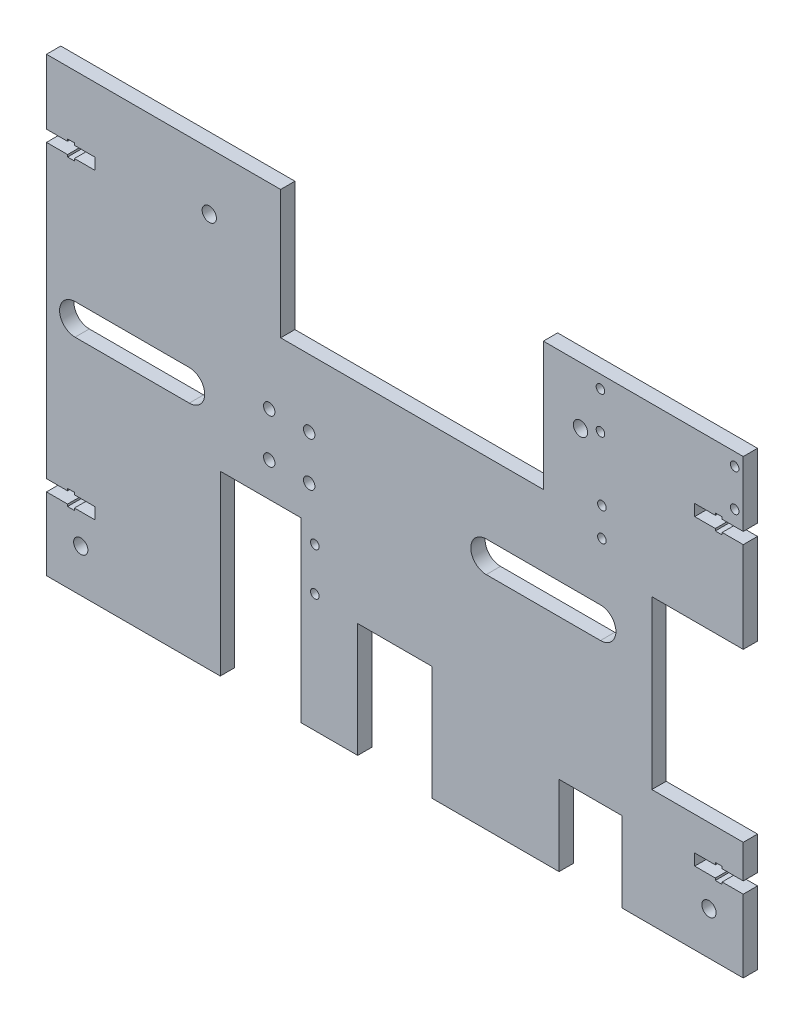
from build123d import *

# Parameters (mm, degrees)
SKETCH1_W           = 244
SKETCH1_H           = 158.154567899
BOSS_EXTRUDE2_DEPTH = 5
SKETCH2_W           = 28.286613298
SKETCH2_H           = 62.131328865
CUT_EXTRUDE1_DEPTH  = 10
SKETCH7_W           = 32
SKETCH7_H           = 84.5
CUT_EXTRUDE5_DEPTH  = 10
SKETCH9_R           = 1.5
CUT_EXTRUDE7_DEPTH  = 10
SKETCH10_W          = 26
SKETCH10_H          = 40
CUT_EXTRUDE8_DEPTH  = 10
SKETCH12_W          = 92
SKETCH12_H          = 45
CUT_EXTRUDE10_DEPTH = 10
SKETCH13_R          = 2.5
CUT_EXTRUDE11_DEPTH = 10
CUT_EXTRUDE12_DEPTH = 10
SKETCH15_W          = 32
SKETCH15_H          = 26
BOSS_EXTRUDE3_DEPTH = 5
SKETCH16_R          = 1.5
CUT_EXTRUDE13_DEPTH = 10
SKETCH17_R          = 1.5
CUT_EXTRUDE14_DEPTH = 10
SKETCH19_R          = 2
CUT_EXTRUDE16_DEPTH = 10
SKETCH20_W          = 22
SKETCH20_H          = 28
CUT_EXTRUDE17_DEPTH = 10
CUT_EXTRUDE18_DEPTH = 10


with BuildPart() as part:
    # Sketch1 → Boss-Extrude2 (new body)
    with BuildSketch(Plane.XY):
        with Locations((-3, -45.239754423)):
            Rectangle(SKETCH1_W, SKETCH1_H)
    extrude(amount=BOSS_EXTRUDE2_DEPTH)

    # Sketch2 → Cut-Extrude1 (cut)
    with BuildSketch(Plane(origin=(0, 0, 0), x_dir=(-1, 0, 0), z_dir=(0, 0, -1))):
        with Locations((50, -93.25137394)):
            Rectangle(SKETCH2_W, SKETCH2_H)
    extrude(amount=-CUT_EXTRUDE1_DEPTH, mode=Mode.SUBTRACT)

    # Sketch7 → Cut-Extrude5 (cut)
    with BuildSketch(Plane(origin=(0, 0, 0), x_dir=(-1, 0, 0), z_dir=(0, 0, -1))):
        with Locations((-103, -40.912470473)):
            Rectangle(SKETCH7_W, SKETCH7_H)
    extrude(amount=-CUT_EXTRUDE5_DEPTH, mode=Mode.SUBTRACT)

    # Sketch9 → Cut-Extrude7 (cut)
    with BuildSketch(Plane(origin=(0, 0, 0), x_dir=(-1, 0, 0), z_dir=(0, 0, -1))):
        with Locations((31.026566737, -67.835709507)):
            Circle(SKETCH9_R)
        with Locations((31.026566737, -82.835709507)):
            Circle(SKETCH9_R)
    extrude(amount=-CUT_EXTRUDE7_DEPTH, mode=Mode.SUBTRACT)

    # Sketch10 → Cut-Extrude8 (cut)
    with BuildSketch(Plane(origin=(0, 0, 0), x_dir=(-1, 0, 0), z_dir=(0, 0, -1))):
        with Locations((3, -104.317038372)):
            Rectangle(SKETCH10_W, SKETCH10_H)
    extrude(amount=-CUT_EXTRUDE8_DEPTH, mode=Mode.SUBTRACT)

    # Sketch12 → Cut-Extrude10 (cut)
    with BuildSketch(Plane(origin=(0, 0, 0), x_dir=(-1, 0, 0), z_dir=(0, 0, -1))):
        with Locations((-3, 11.337529527)):
            Rectangle(SKETCH12_W, SKETCH12_H)
    extrude(amount=-CUT_EXTRUDE10_DEPTH, mode=Mode.SUBTRACT)

    # Sketch13 → Cut-Extrude11 (cut)
    with BuildSketch(Plane(origin=(0, 0, 0), x_dir=(-1, 0, 0), z_dir=(0, 0, -1))):
        with Locations((-107, -109.317038372)):
            Circle(SKETCH13_R)
        with Locations((113, -109.317038372)):
            Circle(SKETCH13_R)
        with Locations((-62, 13.837529527)):
            Circle(SKETCH13_R)
        with Locations((68, 13.837529527)):
            Circle(SKETCH13_R)
    extrude(amount=-CUT_EXTRUDE11_DEPTH, mode=Mode.SUBTRACT)

    # Sketch14 → Cut-Extrude12 (cut)
    with BuildSketch(Plane(origin=(0, 0, 0), x_dir=(-1, 0, 0), z_dir=(0, 0, -1))):
        Polygon((-119, -94.885674772), (-119, -98.885674772), (-111.613125162, -98.885674772), (-111.613125162, -99.635674772), (-109.213125162, -99.635674772), (-109.213125162, -98.885674772), (-102, -98.885674772), (-102, -94.885674772), (-109.213125162, -94.885674772), (-109.213125162, -94.135674772), (-111.613125162, -94.135674772), (-111.613125162, -94.885674772), align=None)
        Polygon((-102, 11.114325228), (-109.213125162, 11.114325228), (-109.213125162, 11.864325228), (-111.613125162, 11.864325228), (-111.613125162, 11.114325228), (-119, 11.114325228), (-119, 7.114325228), (-111.613125162, 7.114325228), (-111.613125162, 6.364325228), (-109.213125162, 6.364325228), (-109.213125162, 7.114325228), (-102, 7.114325228), align=None)
        Polygon((117.613125162, 7.114325228), (125, 7.114325228), (125, 11.114325228), (117.613125162, 11.114325228), (117.613125162, 11.864325228), (115.213125162, 11.864325228), (115.213125162, 11.114325228), (108, 11.114325228), (108, 7.114325228), (115.213125162, 7.114325228), (115.213125162, 6.364325228), (117.613125162, 6.364325228), align=None)
        Polygon((117.613125162, -98.885674772), (125, -98.885674772), (125, -94.885674772), (117.613125162, -94.885674772), (117.613125162, -94.135674772), (115.213125162, -94.135674772), (115.213125162, -94.885674772), (108, -94.885674772), (108, -98.885674772), (115.213125162, -98.885674772), (115.213125162, -99.635674772), (117.613125162, -99.635674772), align=None)
    extrude(amount=-CUT_EXTRUDE12_DEPTH, mode=Mode.SUBTRACT)

    # Sketch15 → Boss-Extrude3 (add)
    with BuildSketch(Plane(origin=(0, 0, 0), x_dir=(-1, 0, 0), z_dir=(0, 0, -1))):
        with Locations((-103, -11.662470473)):
            Rectangle(SKETCH15_W, SKETCH15_H)
    extrude(amount=-BOSS_EXTRUDE3_DEPTH)

    # Sketch16 → Cut-Extrude13 (cut)
    with BuildSketch(Plane(origin=(0, 0, 0), x_dir=(-1, 0, 0), z_dir=(0, 0, -1))):
        with Locations((-69.5, -5.762708109)):
            Circle(SKETCH16_R)
        with Locations((-69.5, -15.762708109)):
            Circle(SKETCH16_R)
    extrude(amount=-CUT_EXTRUDE13_DEPTH, mode=Mode.SUBTRACT)

    # Sketch17 → Cut-Extrude14 (cut)
    with BuildSketch(Plane(origin=(0, 0, 0), x_dir=(-1, 0, 0), z_dir=(0, 0, -1))):
        with Locations((-69, 16.337529527)):
            Circle(SKETCH17_R)
        with Locations((-69, 29.337529527)):
            Circle(SKETCH17_R)
        with Locations((-116, 16.337529527)):
            Circle(SKETCH17_R)
        with Locations((-116, 29.337529527)):
            Circle(SKETCH17_R)
    extrude(amount=-CUT_EXTRUDE14_DEPTH, mode=Mode.SUBTRACT)

    # Sketch19 → Cut-Extrude16 (cut)
    with BuildSketch(Plane(origin=(0, 0, 0), x_dir=(-1, 0, 0), z_dir=(0, 0, -1))):
        with Locations((33, -34.730312102)):
            Circle(SKETCH19_R)
        with Locations((47, -34.730312102)):
            Circle(SKETCH19_R)
        with Locations((33, -50.230312102)):
            Circle(SKETCH19_R)
        with Locations((47, -50.230312102)):
            Circle(SKETCH19_R)
    extrude(amount=-CUT_EXTRUDE16_DEPTH, mode=Mode.SUBTRACT)

    # Sketch20 → Cut-Extrude17 (cut)
    with BuildSketch(Plane(origin=(0, 0, 0), x_dir=(-1, 0, 0), z_dir=(0, 0, -1))):
        with Locations((-65.5, -110.317038372)):
            Rectangle(SKETCH20_W, SKETCH20_H)
    extrude(amount=-CUT_EXTRUDE17_DEPTH, mode=Mode.SUBTRACT)

    # Sketch21 → Cut-Extrude18 (cut)
    with BuildSketch(Plane(origin=(0, 0, 0), x_dir=(-1, 0, 0), z_dir=(0, 0, -1))):
        with BuildLine():
            Line((-29, -36.162470473), (-69, -36.162470473))
            ThreePointArc((-69, -36.162470473), (-74.402823378, -41.565293851), (-69, -46.968117229))
            Line((-69, -46.968117229), (-29, -46.968117229))
            ThreePointArc((-29, -46.968117229), (-23.597176622, -41.565293851), (-29, -36.162470473))
        make_face()
        with BuildLine():
            Line((115, -36.162470473), (75, -36.162470473))
            ThreePointArc((75, -36.162470473), (69.597176622, -41.565293851), (75, -46.968117229))
            Line((75, -46.968117229), (115, -46.968117229))
            ThreePointArc((115, -46.968117229), (120.402823378, -41.565293851), (115, -36.162470473))
        make_face()
    extrude(amount=-CUT_EXTRUDE18_DEPTH, mode=Mode.SUBTRACT)


solid = part.part
